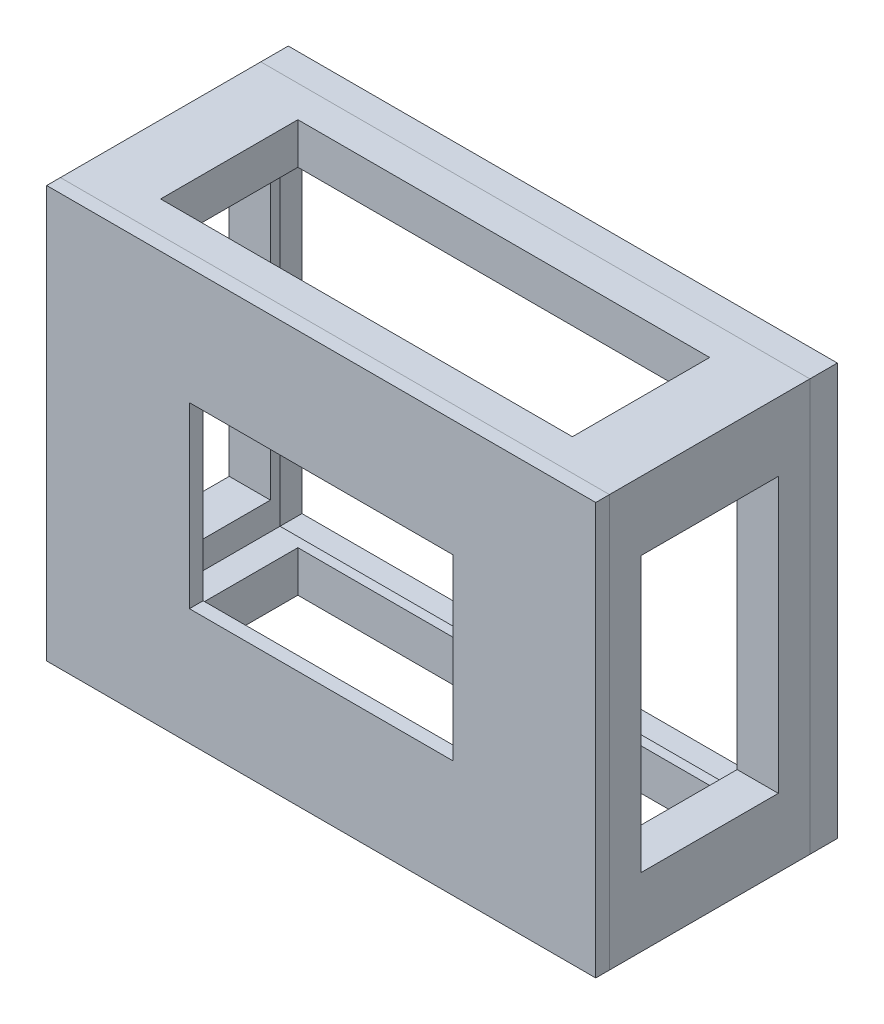
from build123d import *

# Parameters (mm, degrees)
SKETCH1_W           = 30
SKETCH1_H           = 40
SKETCH1_W_2         = 13
SKETCH1_H_2         = 19.2
BOSS_EXTRUDE1_DEPTH = 1
SKETCH2_W           = 40
SKETCH2_H           = 30
SKETCH2_W_2         = 34
SKETCH2_H_2         = 24
BOSS_EXTRUDE2_DEPTH = 13
SKETCH3_W           = 40
SKETCH3_H           = 30
SKETCH3_W_2         = 38
SKETCH3_H_2         = 28
BOSS_EXTRUDE3_DEPTH = 1.6
SKETCH4_W           = 40
SKETCH4_H           = 30
BOSS_EXTRUDE4_DEPTH = 2
CHAMFER1_SIZE       = 0.5
CHAMFER2_SIZE       = 0.5
SKETCH5_W           = 30
SKETCH5_H           = 10
CUT_EXTRUDE1_DEPTH  = 70
SKETCH6_W           = 20
SKETCH6_H           = 10
CUT_EXTRUDE2_DEPTH  = 70


with BuildPart() as part:
    # Sketch1 → Boss-Extrude1 (new body)
    with BuildSketch(Plane(origin=(0, 0, 0), x_dir=(0, 1, 0), z_dir=(0, 0, 1))):
        Rectangle(SKETCH1_W, SKETCH1_H)
        Rectangle(SKETCH1_W_2, SKETCH1_H_2, mode=Mode.SUBTRACT)
    extrude(amount=BOSS_EXTRUDE1_DEPTH)


with BuildPart() as body_2:
    # Sketch2 → Boss-Extrude2 (new body)
    with BuildSketch(Plane(origin=(0, 0, 0), x_dir=(1, 0, 0), z_dir=(0, 0, -1))):
        Rectangle(SKETCH2_W, SKETCH2_H)
        Rectangle(SKETCH2_W_2, SKETCH2_H_2, mode=Mode.SUBTRACT)
    extrude(amount=BOSS_EXTRUDE2_DEPTH)

    # Sketch3 → Boss-Extrude3 (add)
    with BuildSketch(Plane(origin=(0, 0, -13), x_dir=(1, 0, 0), z_dir=(0, 0, -1))):
        Rectangle(SKETCH3_W, SKETCH3_H)
        Rectangle(SKETCH3_W_2, SKETCH3_H_2, mode=Mode.SUBTRACT)
    extrude(amount=BOSS_EXTRUDE3_DEPTH)

    # Sketch5 → Cut-Extrude1 (cut)
    with BuildSketch(Plane.XZ.offset(15)):
        with Locations((0, -7.3)):
            Rectangle(SKETCH5_W, SKETCH5_H)
    extrude(amount=-CUT_EXTRUDE1_DEPTH, mode=Mode.SUBTRACT)

    # Sketch6 → Cut-Extrude2 (cut)
    with BuildSketch(Plane.YZ.offset(20)):
        with Locations((0, -7.3)):
            Rectangle(SKETCH6_W, SKETCH6_H)
    extrude(amount=-CUT_EXTRUDE2_DEPTH, mode=Mode.SUBTRACT)


with BuildPart() as body_3:
    # Sketch4 → Boss-Extrude4 (new body)
    with BuildSketch(Plane(origin=(0, 0, -14.6), x_dir=(1, 0, 0), z_dir=(0, 0, -1))):
        Rectangle(SKETCH4_W, SKETCH4_H)
        Polygon((19, -14), (19, 14), (1, 14), (1, 13), (-1, 13), (-1, 14), (-19, 14), (-19, -14), (-1, -14), (-1, -13), (1, -13), (1, -14), align=None, mode=Mode.SUBTRACT)
    extrude(amount=BOSS_EXTRUDE4_DEPTH)

    # Chamfer1
    chamfer1_edges = [body_3.edges().sort_by_distance(p)[0] for p in [
        (0, 13, -14.6),
        (0, 13, -16.6),
    ]]
    chamfer(chamfer1_edges, length=CHAMFER1_SIZE)

    # Chamfer2
    chamfer2_edges = [body_3.edges().sort_by_distance(p)[0] for p in [
        (0, -13, -14.6),
        (0, -13, -16.6),
    ]]
    chamfer(chamfer2_edges, length=CHAMFER2_SIZE)


solid = Compound([part.part, body_2.part, body_3.part])
